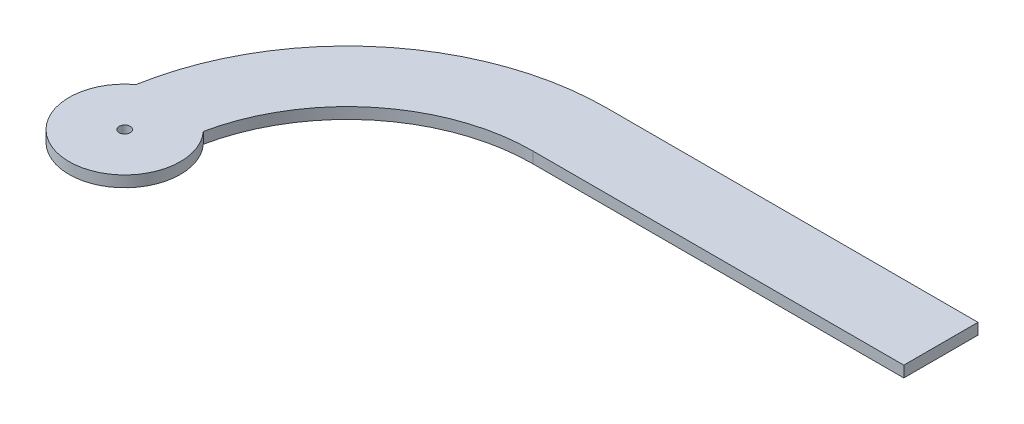
from build123d import *

# Parameters (mm, degrees)
SKETCH1_R           = 1.5
BOSS_EXTRUDE1_DEPTH = 3


with BuildPart() as part:
    # Sketch1 → Boss-Extrude1 (new body)
    with BuildSketch(Plane(origin=(0, 0, 0), x_dir=(1, 0, 0), z_dir=(0, 1, 0))):
        with BuildLine():
            Line((0, 50), (100, 50))
            Line((100, 50), (100, 70))
            Line((100, 70), (0, 70))
            ThreePointArc((0, 70), (-45.043425666, 53.582551304), (-68.958333333, 12.031137265))
            ThreePointArc((-68.958333333, 12.031137265), (-61.402498888, -14.934289299), (-48.958333333, 10.152910776))
            ThreePointArc((-48.958333333, 10.152910776), (-31.562275435, 38.779153799), (0, 50))
        make_face()
        with Locations(Location((-60, 0, 0), (0, 0, 270))):
            Circle(SKETCH1_R, mode=Mode.SUBTRACT)
    extrude(amount=BOSS_EXTRUDE1_DEPTH)


solid = part.part
